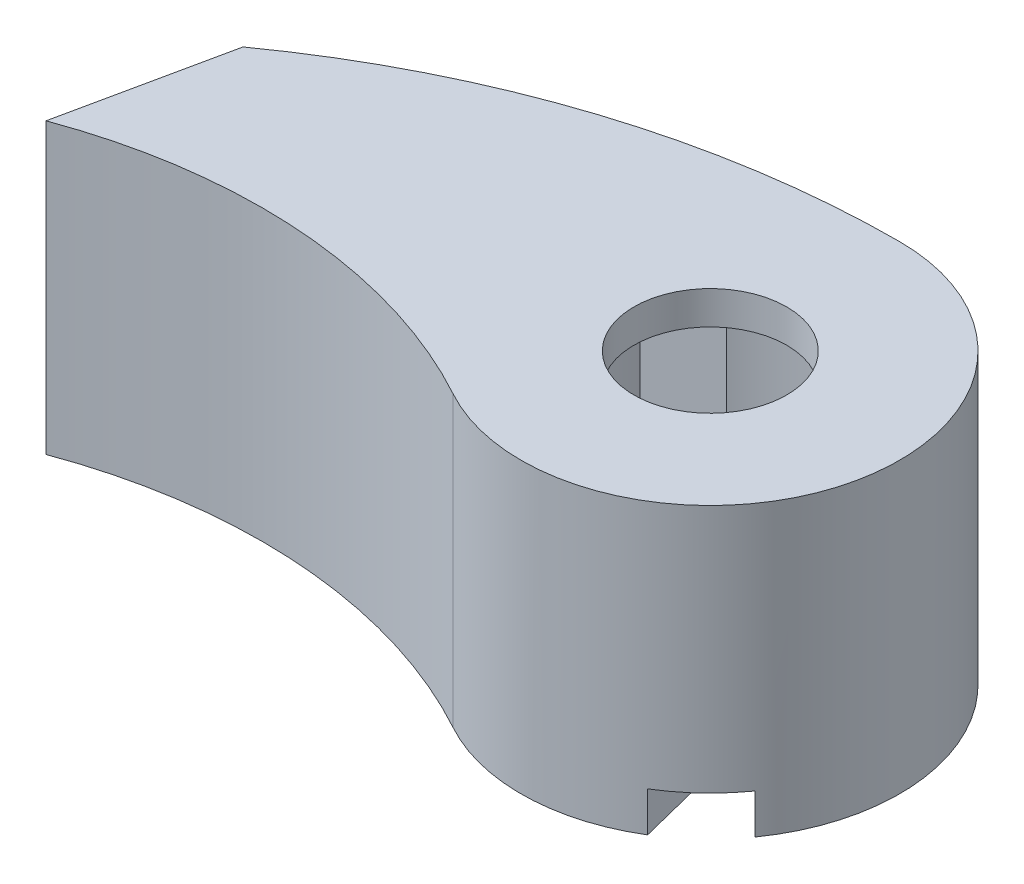
from build123d import *

# Parameters (mm, degrees)
BOSS_EXTRUDE1_DEPTH = 0.5
BOSS_EXTRUDE2_START = -3.85
BOSS_EXTRUDE2_DEPTH = 3.85
SKETCH2_R           = 1.15
CUT_EXTRUDE1_DEPTH  = 10
CUT_EXTRUDE2_START  = 3.85
CUT_EXTRUDE2_DEPTH  = 0.6


with BuildPart() as part:
    # Sketch1 → Boss-Extrude1 (new body)
    with BuildSketch(Plane(origin=(0, 0, 0), x_dir=(1, 0, 0), z_dir=(0, 1, 0))):
        with BuildLine():
            Line((-8, -2), (-7.480220773, 0.445369002))
            ThreePointArc((-7.480220773, 0.445369002), (-3.928611493, 2.234065485), (0, 2.85))
            ThreePointArc((0, 2.85), (2.760304316, -0.709380069), (-1.374108678, -2.4968631))
            ThreePointArc((-1.374108678, -2.4968631), (-4.633030541, -1.528000078), (-8, -2))
        make_face()
    extrude(amount=BOSS_EXTRUDE1_DEPTH)

    # Sketch1<3> → Boss-Extrude2 (add)
    with BuildSketch(Plane(origin=(0, 0, 0), x_dir=(1, 0, 0), z_dir=(0, 1, 0)).offset(BOSS_EXTRUDE2_START)):
        with BuildLine():
            Line((-8, -2), (-7.480220773, 0.445369002))
            ThreePointArc((-7.480220773, 0.445369002), (-3.928611493, 2.234065485), (0, 2.85))
            ThreePointArc((0, 2.85), (2.760304316, -0.709380069), (-1.374108678, -2.4968631))
            ThreePointArc((-1.374108678, -2.4968631), (-4.633030541, -1.528000078), (-8, -2))
        make_face()
        with BuildLine():
            Line((-6.516291445, 0.083732705), (-1.181900943, 1.423239319))
            ThreePointArc((-1.181900943, 1.423239319), (1.501730026, -1.080419793), (-1.725107949, 0.668208473))
            Line((-1.725107949, 0.668208473), (-6.370163451, -0.498200805))
            Line((-6.370163451, -0.498200805), (-6.516291445, 0.083732705))
        make_face(mode=Mode.SUBTRACT)
    extrude(amount=BOSS_EXTRUDE2_DEPTH)

    # Sketch2 → Cut-Extrude1 (cut)
    with BuildSketch(Plane.XZ):
        with Locations(Location((0, 0, 0), (0, 0, 270))):
            Circle(SKETCH2_R)
    extrude(amount=-CUT_EXTRUDE1_DEPTH, mode=Mode.SUBTRACT)

    # Sketch3 → Cut-Extrude2 (cut)
    with BuildSketch(Plane.XZ.offset(CUT_EXTRUDE2_START)):
        with BuildLine():
            Line((1.085530532, 0.832876632), (1.48692434, 2.431369163))
            ThreePointArc((1.48692434, 2.431369163), (1.944053318, 2.08402416), (2.322291558, 1.652108326))
            Line((2.322291558, 1.652108326), (1.794294987, -0.450561316))
            Line((1.794294987, -0.450561316), (1.085530532, 0.832876632))
        make_face()
    extrude(amount=-CUT_EXTRUDE2_DEPTH, mode=Mode.SUBTRACT)


solid = part.part
